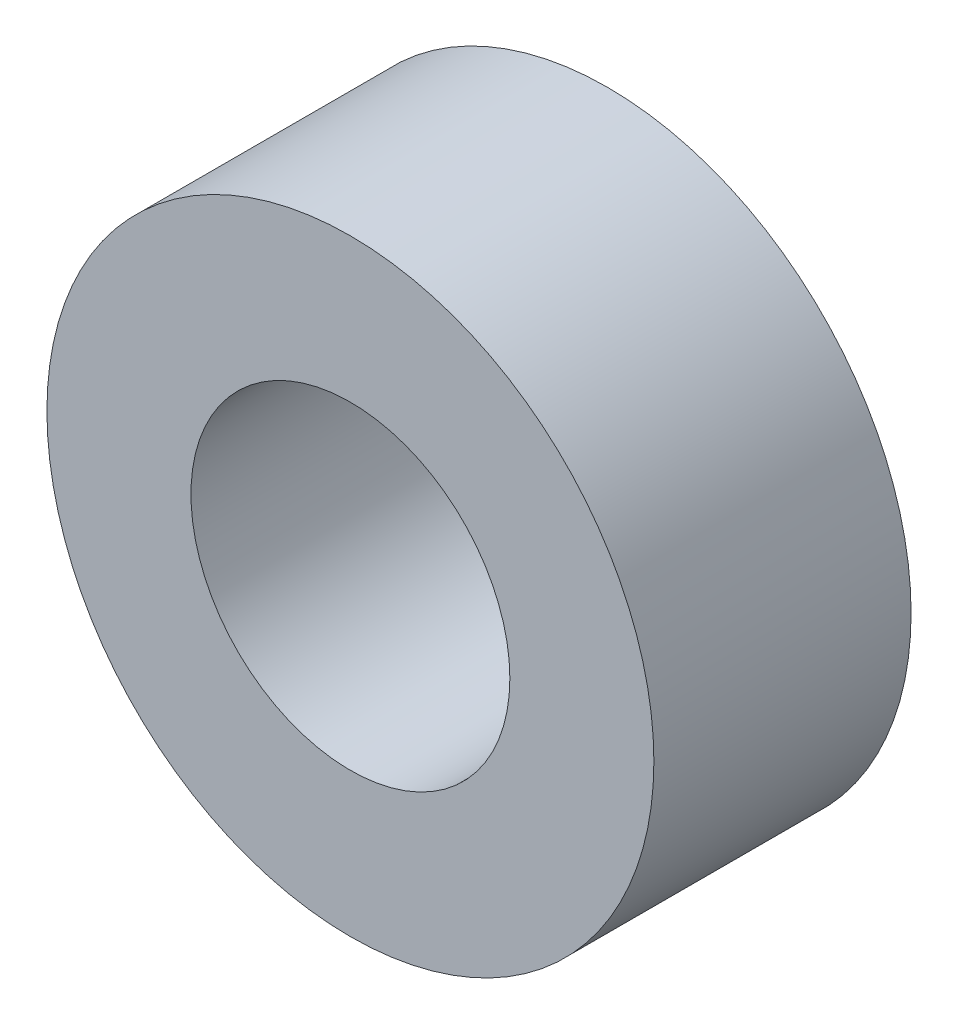
from build123d import *

# Parameters (mm, degrees)
SKETCH1_R           = 5.9
SKETCH1_R_2         = 3.1
BOSS_EXTRUDE1_DEPTH = 5


with BuildPart() as part:
    # Sketch1 → Boss-Extrude1 (new body)
    with BuildSketch(Plane.XY):
        Circle(SKETCH1_R)
        Circle(SKETCH1_R_2, mode=Mode.SUBTRACT)
    extrude(amount=BOSS_EXTRUDE1_DEPTH)


solid = part.part
